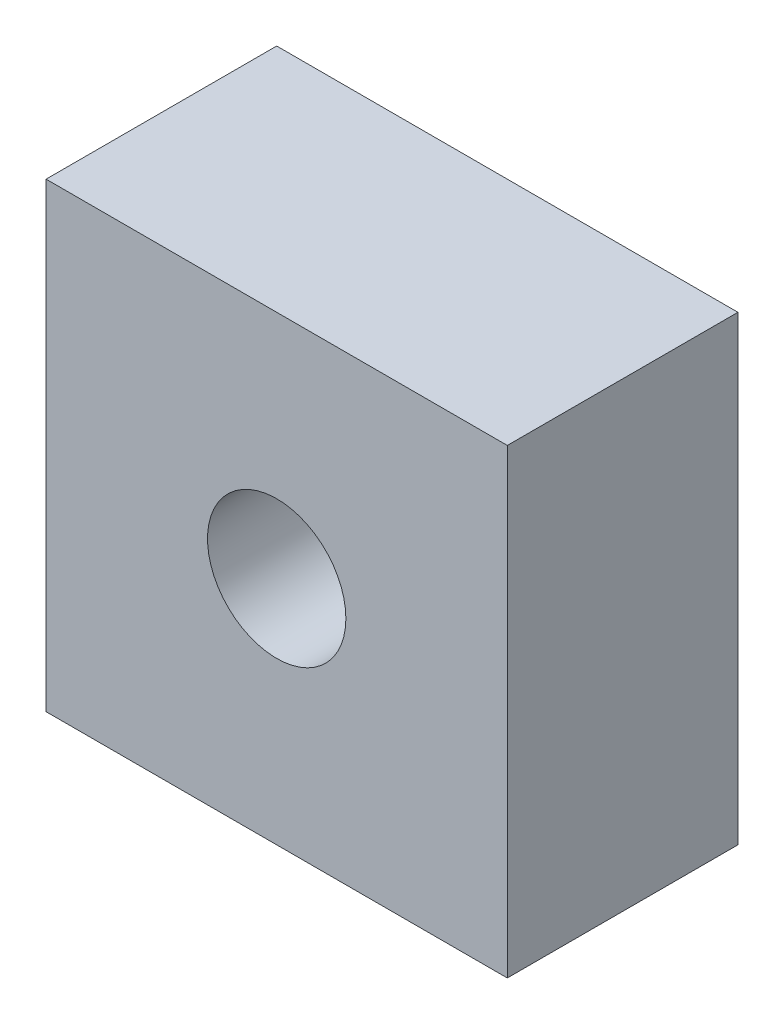
from build123d import *

# Parameters (mm, degrees)
SKETCH_1_W              = 20
SKETCH_1_H              = 20
BASEBOX_DEPTH           = 10
SKETCH_2_R              = 3
UPTOSURFACEMODIFY_DEPTH = 10


with BuildPart() as part:
    # 草图1 → BaseBox (new body)
    with BuildSketch(Plane.XY):
        with Locations((10, 10)):
            Rectangle(SKETCH_1_W, SKETCH_1_H)
    extrude(amount=BASEBOX_DEPTH)

    # 草图2 → UpToSurfaceModify (cut)
    with BuildSketch(Plane.XY.offset(10)):
        with Locations((10, 10)):
            Circle(SKETCH_2_R)
    extrude(amount=-UPTOSURFACEMODIFY_DEPTH, mode=Mode.SUBTRACT)


solid = part.part
